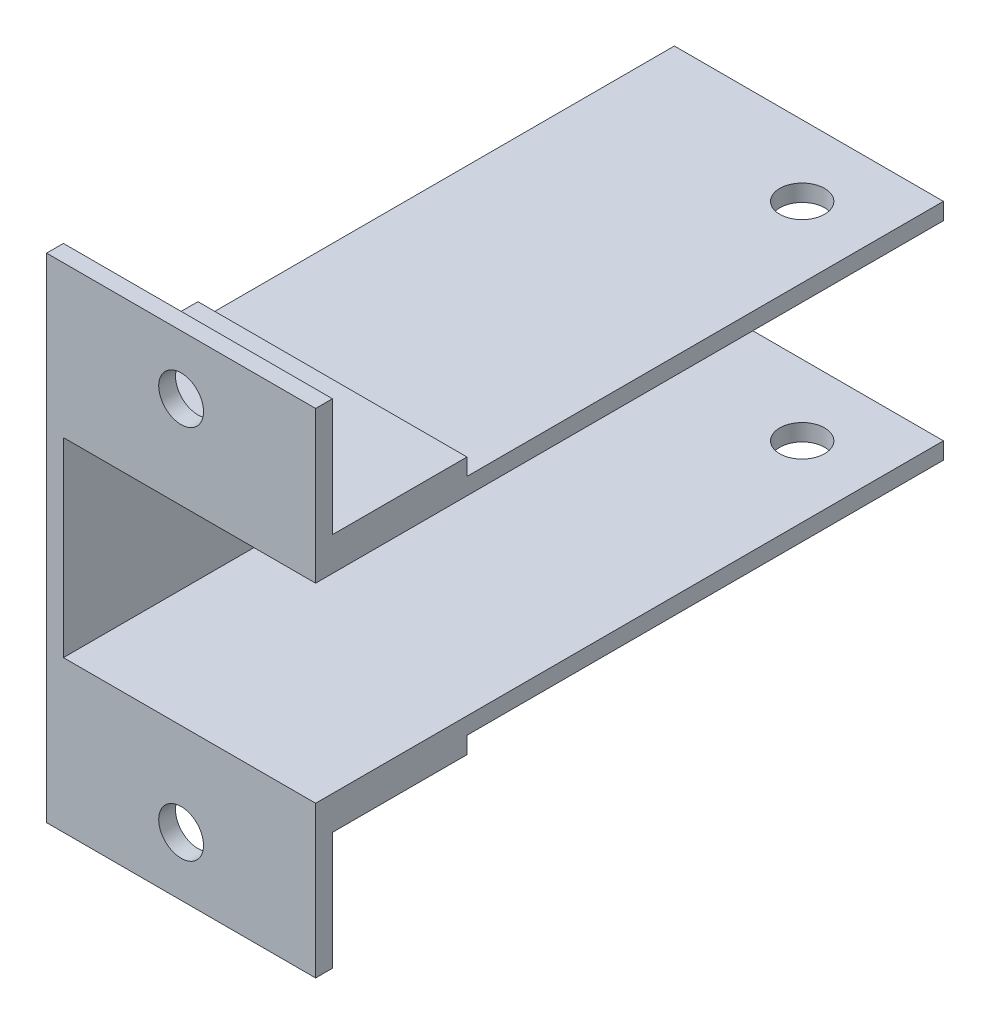
from build123d import *

# Parameters (mm, degrees)
SALIENTE_EXTRUIR1_DEPTH = 88.9
CROQUIS2_W              = 38.1
CROQUIS2_H              = 4.7625
CROQUIS2_W_2            = 4.7625
CROQUIS2_H_2            = 38.1
SALIENTE_EXTRUIR2_DEPTH = 76.2
CROQUIS4_R              = 6.35
CORTAR_EXTRUIR2_DEPTH   = 77.8
CROQUIS5_R              = 6.35
CORTAR_EXTRUIR3_DEPTH   = 77.8


with BuildPart() as part:
    # Croquis1 → Saliente-Extruir1 (new, symmetric)
    with BuildSketch(Plane.XY):
        Polygon((0, 31.75), (0, -31.75), (76.2, -31.75), (76.2, -26.9875), (4.7625, -26.9875), (4.7625, 26.9875), (76.2, 26.9875), (76.2, 31.75), align=None)
    extrude(amount=SALIENTE_EXTRUIR1_DEPTH, both=True)

    # Croquis2 → Saliente-Extruir2 (add, through all)
    with BuildSketch(Plane(origin=(0, 0, 0), x_dir=(0, 0, -1), z_dir=(1, 0, 0))):
        with Locations((-65.0875, 34.13125)):
            Rectangle(CROQUIS2_W, CROQUIS2_H)
        with Locations((-86.51875, 50.8)):
            Rectangle(CROQUIS2_W_2, CROQUIS2_H_2)
    saliente_extruir2 = extrude(amount=SALIENTE_EXTRUIR2_DEPTH)

    # Croquis4 → Cortar-Extruir2 (cut)
    with BuildSketch(Plane(origin=(0, 0, 84.1375), x_dir=(-1, 0, 0), z_dir=(0, 0, -1))):
        with Locations(Location((-38.1, 53.18125, 0), (0, 0, 90))):
            Circle(CROQUIS4_R)
    cortar_extruir2 = extrude(amount=-CORTAR_EXTRUIR2_DEPTH, mode=Mode.SUBTRACT)

    # Simetría3: Saliente-Extruir2, Cortar-Extruir2 across plane
    add(saliente_extruir2.mirror(Plane.ZX))
    add(cortar_extruir2.mirror(Plane.ZX), mode=Mode.SUBTRACT)

    # Croquis5 → Cortar-Extruir3 (cut)
    with BuildSketch(Plane(origin=(0, -31.75, 0), x_dir=(-1, 0, 0), z_dir=(0, -1, 0))):
        with Locations(Location((-56.2, 68.9, 0), (0, 0, 180))):
            Circle(CROQUIS5_R)
    extrude(amount=-CORTAR_EXTRUIR3_DEPTH, mode=Mode.SUBTRACT)


solid = part.part
